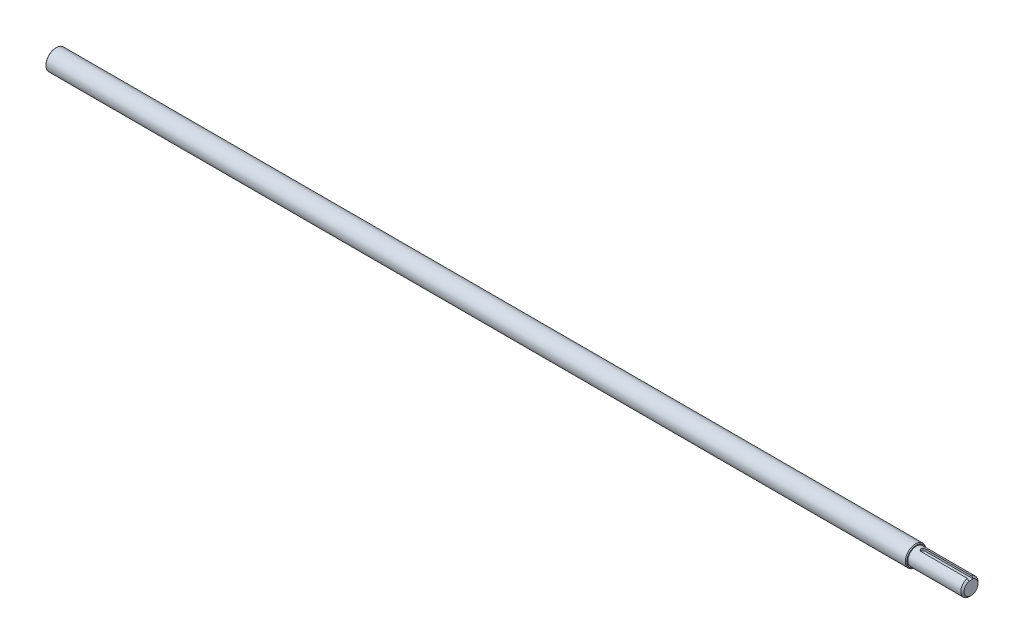
from build123d import *

# Parameters (mm, degrees)
BOSS_EXTRUDE1_DEPTH      = 304.8
BOSS_EXTRUDE1_DEPTH_BACK = 304.8
SKETCH4_R                = 4.7625
CHAMFER1_SIZE            = 0.24765
CUT_EXTRUDE1_START       = 4
CUT_EXTRUDE1_DEPTH       = 1


with BuildPart() as part:
    # Sketch4 → Boss-Extrude1 (new, two sides: drawn at the far end of the back side and taken through both)
    with BuildSketch(Plane(origin=(0, 0, 0), x_dir=(0, 0, -1), z_dir=(1, 0, 0)).offset(-BOSS_EXTRUDE1_DEPTH_BACK)):
        with Locations(Location((0, 0, 0), (0, 0, 180))):
            Circle(SKETCH4_R)
    extrude(amount=BOSS_EXTRUDE1_DEPTH + BOSS_EXTRUDE1_DEPTH_BACK)

    # Chamfer1
    chamfer1_edges = [part.edges().sort_by_distance(p)[0] for p in [
        (-304.8, 0, -4.7625),
        (304.8, 0, -4.7625),
    ]]
    chamfer(chamfer1_edges, length=CHAMFER1_SIZE)

    # Sketch5 → Cut-Revolve1 (revolve, cut)
    with BuildSketch(Plane.XY, mode=Mode.PRIVATE) as cut_revolve1_sk:
        Polygon((304.8, 0), (120.65, 0), (120.65, 3.238), (119.888, 4), (95.25, 4), (95.25, 4.3815), (94.869, 4.7625), (304.8, 4.7625), align=None)
    revolve(cut_revolve1_sk.sketch.rotate(Axis((120.65, 0, 0), (1, 0, 0)), 90), axis=Axis((120.65, 0, 0), (1, 0, 0)), mode=Mode.SUBTRACT)

    # Sketch6 → Cut-Extrude1 (cut)
    with BuildSketch(Plane(origin=(0, 0, 0), x_dir=(1, 0, 0), z_dir=(0, 1, 0)).offset(CUT_EXTRUDE1_START)):
        with BuildLine():
            Line((120.65, -1), (98.425, -1))
            ThreePointArc((98.425, -1), (97.425, 0), (98.425, 1))
            Line((98.425, 1), (120.65, 1))
            ThreePointArc((120.65, 1), (121.65, 0), (120.65, -1))
        make_face()
    extrude(amount=-CUT_EXTRUDE1_DEPTH, mode=Mode.SUBTRACT)


solid = part.part
